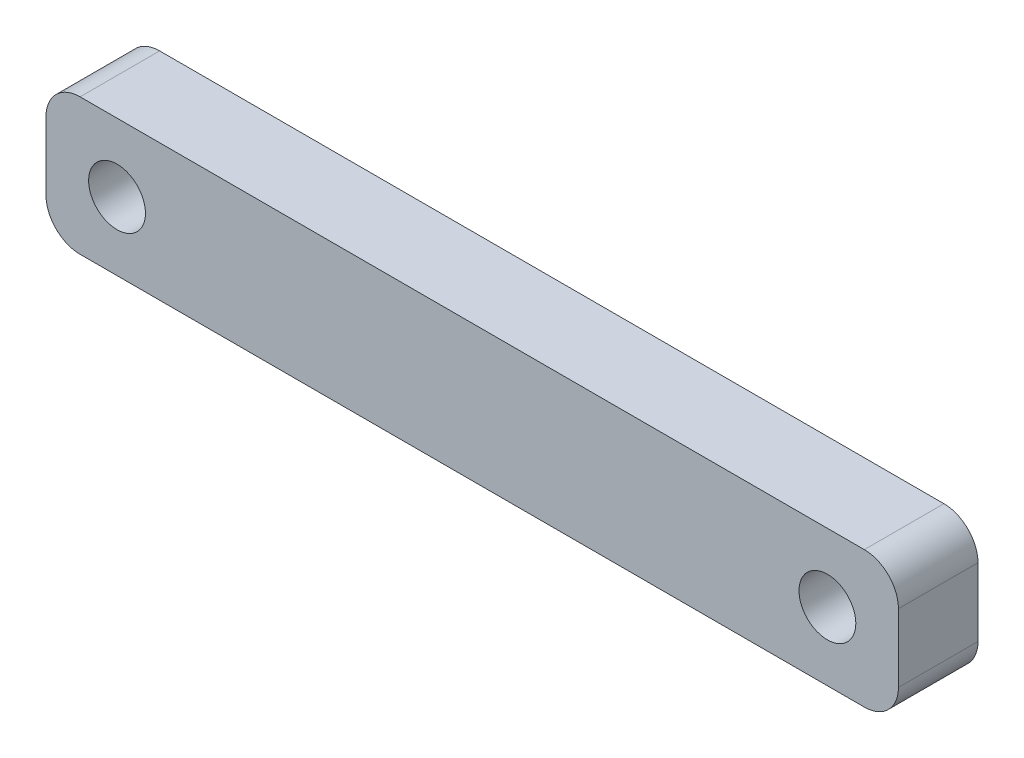
from build123d import *

# Parameters (mm, degrees)
SKETCH1_W           = 75
SKETCH1_H           = 12
SKETCH1_R           = 2.5
BOSS_EXTRUDE1_DEPTH = 7
FILLET1_R           = 3


with BuildPart() as part:
    # Sketch1 → Boss-Extrude1 (new body)
    with BuildSketch(Plane.XY):
        Rectangle(SKETCH1_W, SKETCH1_H)
        with Locations((31.25, 0)):
            Circle(SKETCH1_R, mode=Mode.SUBTRACT)
        with Locations((-31.25, 0)):
            Circle(SKETCH1_R, mode=Mode.SUBTRACT)
    extrude(amount=BOSS_EXTRUDE1_DEPTH)

    # Fillet1
    fillet1_edges = [part.edges().sort_by_distance(p)[0] for p in [
        (37.5, -6, 3.5),
        (-37.5, -6, 3.5),
        (-37.5, 6, 3.5),
        (37.5, 6, 3.5),
    ]]
    fillet(fillet1_edges, radius=FILLET1_R)


solid = part.part
